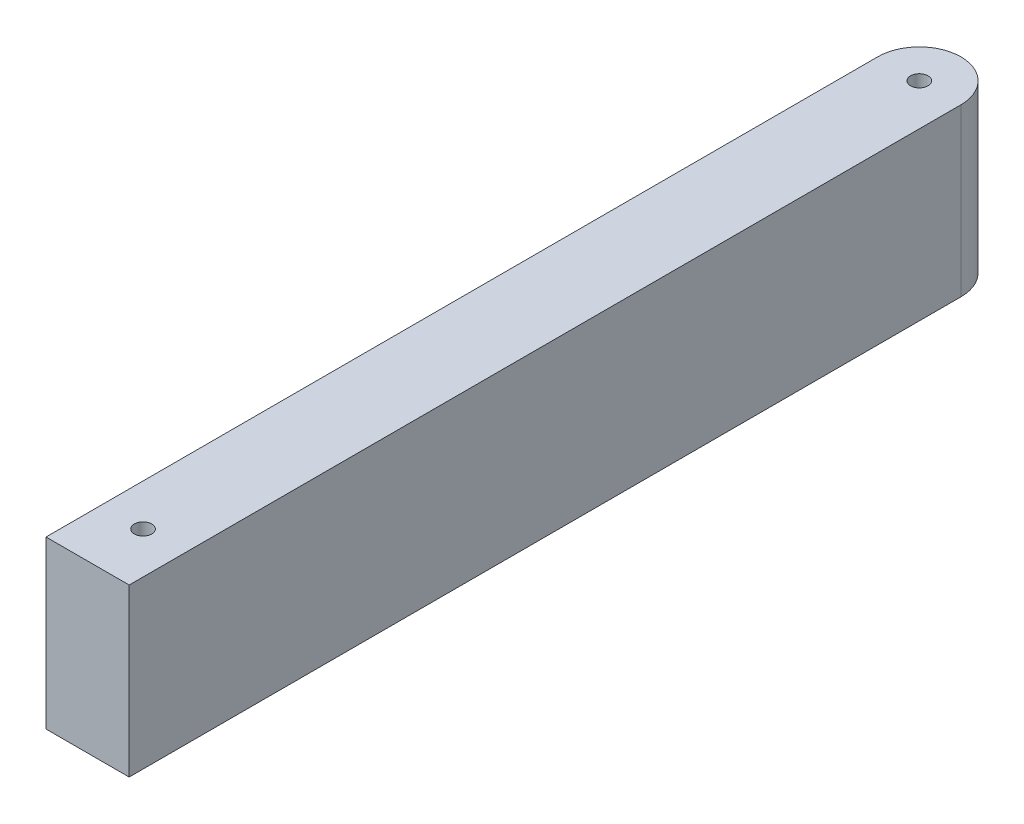
from build123d import *

# Parameters (mm, degrees)
SKETCH1_W           = 19.05
SKETCH1_H           = 76.2
REVOLVE1_ANGLE      = 180
SKETCH2_W           = 38.1
SKETCH2_H           = 76.2
BOSS_EXTRUDE1_DEPTH = 381
SKETCH3_R           = 3.9878
CUT_EXTRUDE1_DEPTH  = 391.408824183
SKETCH4_R           = 3.9878
CUT_EXTRUDE2_DEPTH  = 391.408824183


with BuildPart() as part:
    # Sketch1 → Revolve1 (revolve)
    with BuildSketch(Plane.XY):
        with Locations((9.525, -38.1)):
            Rectangle(SKETCH1_W, SKETCH1_H)
    revolve(axis=Axis((19.05, 0, 0), (0, -1, 0)), revolution_arc=REVOLVE1_ANGLE)

    # Sketch2 → Boss-Extrude1 (add)
    with BuildSketch(Plane.XY):
        with Locations((19.05, -38.1)):
            Rectangle(SKETCH2_W, SKETCH2_H)
    extrude(amount=BOSS_EXTRUDE1_DEPTH)

    # Sketch3 → Cut-Extrude1 (cut, through all)
    with BuildSketch(Plane(origin=(0, 0, 0), x_dir=(1, 0, 0), z_dir=(0, 1, 0))):
        with Locations(Location((19.05, 0, 0), (0, 0, 180))):
            Circle(SKETCH3_R)
    extrude(amount=-CUT_EXTRUDE1_DEPTH, mode=Mode.SUBTRACT)

    # Sketch4 → Cut-Extrude2 (cut, through all)
    with BuildSketch(Plane(origin=(0, 0, 0), x_dir=(1, 0, 0), z_dir=(0, 1, 0))):
        with Locations(Location((19.05, -355.6, 0), (0, 0, 180))):
            Circle(SKETCH4_R)
    extrude(amount=-CUT_EXTRUDE2_DEPTH, mode=Mode.SUBTRACT)


solid = part.part
